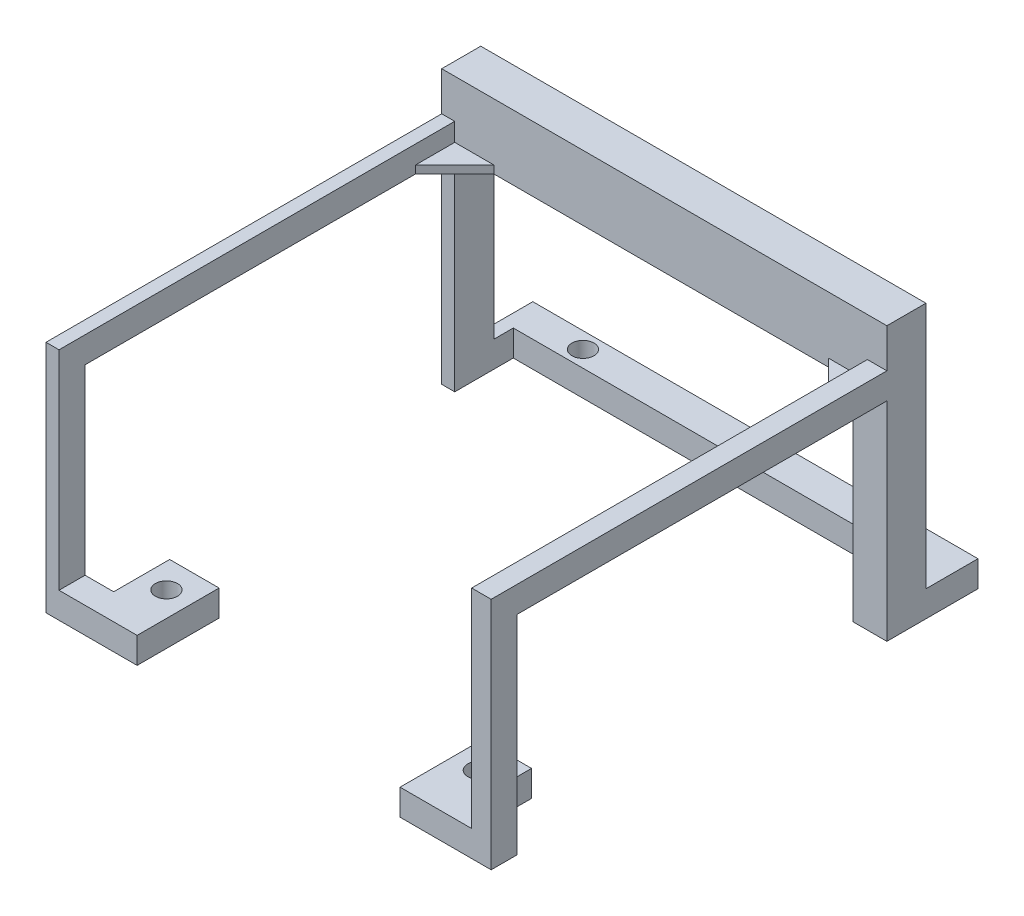
from build123d import *

# Parameters (mm, degrees)
SKETCH1_R                                = 4.25
BOSS_EXTRUDE1_DEPTH                      = 10
BOSS_EXTRUDE2_START                      = -5
BOSS_EXTRUDE2_DEPTH                      = 15
SKETCH3_W                                = 342
SKETCH3_H                                = 10
BOSS_EXTRUDE3_DEPTH                      = 304
CUT_EXTRUDE1_REACH                       = 385.234
BOSS_EXTRUDE4_DEPTH                      = 3
MIRROR5_AT_THE_SECOND_PLANE_COPY_1_DEPTH = 3
BOSS_EXTRUDE5_DEPTH                      = 5
BOSS_EXTRUDE5_DEPTH_BACK                 = 5
BOSS_EXTRUDE6_DEPTH                      = 10
SKETCH10_W                               = 19
SKETCH10_H                               = 21.5
SKETCH10_R                               = 4.25
BOSS_EXTRUDE7_DEPTH                      = 10
CUT_EXTRUDE2_REACH                       = 276.29
SKETCH11_W                               = 2.5
SKETCH11_H                               = 70
MIRROR8_COPY_1_DEPTH                     = 10
MIRROR8_COPY_2_DEPTH                     = 10
MIRROR8_COPY_3_SKETCH_W                  = 19
MIRROR8_COPY_3_SKETCH_H                  = 21.5
MIRROR8_COPY_3_SKETCH_R                  = 4.25
MIRROR8_COPY_3_DEPTH                     = 10
CUT_EXTRUDE5_REACH                       = 415.459
SKETCH14_W                               = 574.948758302
SKETCH14_H                               = 178.61459587
CUT_EXTRUDE6_REACH                       = 276.29
SKETCH15_W                               = 297.993149394
SKETCH15_H                               = 172.333387601


with BuildPart() as part:
    # Sketch1 → Boss-Extrude1 (new body)
    with BuildSketch(Plane(origin=(0, 0, 0), x_dir=(1, 0, 0), z_dir=(0, 1, 0))):
        Polygon((-171, 12.5), (171, 12.5), (171, 0), (171, -12.5), (158, -12.5), (158, 0), (-158, 0), (-158, -12.5), (-171, -12.5), align=None)
        with Locations(Location((-145.5, 6.25, 0), (0, 0, 270))):
            Circle(SKETCH1_R, mode=Mode.SUBTRACT)
        with Locations(Location((145.5, 6.25, 0), (0, 0, 90))):
            Circle(SKETCH1_R, mode=Mode.SUBTRACT)
        with Locations(Location((-25.5, 6.25, 0), (0, 0, 270))):
            Circle(SKETCH1_R, mode=Mode.SUBTRACT)
        with Locations(Location((25.5, 6.25, 0), (0, 0, 270))):
            Circle(SKETCH1_R, mode=Mode.SUBTRACT)
    boss_extrude1 = extrude(amount=BOSS_EXTRUDE1_DEPTH)

    # Sketch2 → Boss-Extrude2 (add)
    with BuildSketch(Plane.XY.offset(12.5).offset(BOSS_EXTRUDE2_START)):
        Polygon((-171, 105), (-171, 0), (-158, 0), (-158, 80), (158, 80), (158, 0), (171, 0), (171, 105), align=None)
    boss_extrude2 = extrude(amount=BOSS_EXTRUDE2_DEPTH)

    # Sketch3 → Boss-Extrude3 (add)
    with BuildSketch(Plane.XY.offset(22.5)):
        with Locations((0, 85)):
            Rectangle(SKETCH3_W, SKETCH3_H)
    extrude(amount=BOSS_EXTRUDE3_DEPTH)

    # Sketch4 → Cut-Extrude1 (cut, up to next)
    with BuildSketch(Plane(origin=(0, 105, 0), x_dir=(1, 0, 0), z_dir=(0, 1, 0)), mode=Mode.PRIVATE) as cut_extrude1_sk1:
        Polygon((-163.5, -22.5), (-5, -22.5), (-5, -326.5), (-163.5, -326.5), (-163.5, -39.75), (-163.5, -34.75), align=None)
    cut_extrude1_tool1 = extrude(cut_extrude1_sk1.sketch, amount=-CUT_EXTRUDE1_REACH, mode=Mode.PRIVATE) & part.part
    # Sketch4 → Cut-Extrude1 (cut, up to next)
    with BuildSketch(Plane(origin=(0, 105, 0), x_dir=(1, 0, 0), z_dir=(0, 1, 0)), mode=Mode.PRIVATE) as cut_extrude1_sk2:
        Polygon((163.5, -22.5), (163.5, -51.4723011), (163.5, -326.5), (5, -326.5), (5, -39.75), (5, -22.5), align=None)
    cut_extrude1_tool2 = extrude(cut_extrude1_sk2.sketch, amount=-CUT_EXTRUDE1_REACH, mode=Mode.PRIVATE) & part.part
    add(cut_extrude1_tool1.solids().sort_by_distance((-84.25, 105, 174.5))[0], mode=Mode.SUBTRACT)
    add(cut_extrude1_tool2.solids().sort_by_distance((84.25, 105, 174.5))[0], mode=Mode.SUBTRACT)

    # Mirror3: Boss-Extrude2 across plane
    add(boss_extrude2.mirror(Plane(origin=(0, 0, 174.5), x_dir=(1, 0, 0), z_dir=(0, 0, -1))))

    # Mirror4: Boss-Extrude1 across plane
    add(boss_extrude1.mirror(Plane(origin=(0, 0, 174.5), x_dir=(1, 0, 0), z_dir=(0, 0, -1))))

    # Sketch7 → Boss-Extrude4 (add)
    with BuildSketch(Plane(origin=(0, 80, 0), x_dir=(-1, 0, 0), z_dir=(0, -1, 0))):
        Polygon((-163.5, -22.5), (-148.5, -22.5), (-163.5, -37.5), align=None)
        Polygon((-5, -22.5), (-20, -22.5), (-5, -37.5), align=None)
    boss_extrude4 = extrude(amount=-BOSS_EXTRUDE4_DEPTH)

    # Mirror5: Boss-Extrude4 across plane
    add(boss_extrude4.mirror(Plane(origin=(0, 0, 174.5), x_dir=(1, 0, 0), z_dir=(0, 0, -1))))

    # Mirror5 at the second plane: Boss-Extrude4 across plane
    add(boss_extrude4.mirror(Plane(origin=(0, 0, 0), x_dir=(0, 0, 1), z_dir=(1, 0, 0))))

    # Mirror5 at the second plane copy 1 sketc → Mirror5 at the second plane copy 1 (add)
    with BuildSketch(Plane(origin=(0, 80, 349), x_dir=(1, 0, 0), z_dir=(0, -1, 0))):
        Polygon((-163.5, -22.5), (-148.5, -22.5), (-163.5, -37.5), align=None)
        Polygon((-5, -22.5), (-20, -22.5), (-5, -37.5), align=None)
    extrude(amount=-MIRROR5_AT_THE_SECOND_PLANE_COPY_1_DEPTH)

    # Sketch8 → Boss-Extrude5 (add, two sides: drawn at the far end of the back side and taken through both)
    with BuildSketch(Plane(origin=(0, 0, 0), x_dir=(0, 0, -1), z_dir=(1, 0, 0)).offset(-BOSS_EXTRUDE5_DEPTH_BACK)):
        Polygon((-326.5, 80), (-341.5, 80), (-341.5, 10), (-349, 10), (-349, 0), (-326.5, 0), align=None)
        Polygon((-22.5, 80), (-7.5, 80), (-7.5, 10), (0, 10), (0, 0), (-22.5, 0), align=None)
    extrude(amount=BOSS_EXTRUDE5_DEPTH + BOSS_EXTRUDE5_DEPTH_BACK)

    # Sketch9 → Boss-Extrude6 (add)
    with BuildSketch(Plane(origin=(0, 0, 174.5), x_dir=(-1, 0, 0), z_dir=(0, 0, -1))):
        Polygon((-163.5, 10), (-136, 10), (-136, 0), (-171, 0), (-171, 80), (-163.5, 80), align=None)
    boss_extrude6 = extrude(amount=BOSS_EXTRUDE6_DEPTH)

    # Sketch10 → Boss-Extrude7 (add)
    with BuildSketch(Plane(origin=(0, 10, 0), x_dir=(1, 0, 0), z_dir=(0, 1, 0))):
        with Locations((145.5, -153.75)):
            Rectangle(SKETCH10_W, SKETCH10_H)
        with Locations(Location((145.5, -153.75, 0), (0, 0, 270))):
            Circle(SKETCH10_R, mode=Mode.SUBTRACT)
    boss_extrude7 = extrude(amount=-BOSS_EXTRUDE7_DEPTH)

    # Mirror6: Boss-Extrude6 across plane
    add(boss_extrude6.mirror(Plane(origin=(85.5, 0, 0), x_dir=(0, 0, 1), z_dir=(1, 0, 0))))

    # Mirror7: Boss-Extrude6, Boss-Extrude7 across plane
    add(boss_extrude6.mirror(Plane(origin=(85.5, 0, 0), x_dir=(0, 0, 1), z_dir=(1, 0, 0))))
    add(boss_extrude7.mirror(Plane(origin=(85.5, 0, 0), x_dir=(0, 0, 1), z_dir=(1, 0, 0))))

    # Sketch11 → Cut-Extrude2 (cut, up to next)
    with BuildSketch(Plane.XY.offset(174.5), mode=Mode.PRIVATE) as cut_extrude2_sk1:
        with Locations((6.25, 45)):
            Rectangle(SKETCH11_W, SKETCH11_H)
    cut_extrude2_tool1 = extrude(cut_extrude2_sk1.sketch, amount=-CUT_EXTRUDE2_REACH, mode=Mode.PRIVATE) & part.part
    cut_extrude2 = cut_extrude2_tool1.solids().sort_by_distance((6.25, 45, 174.5))[0]
    add(cut_extrude2, mode=Mode.SUBTRACT)

    # Mirror8: Boss-Extrude6, Boss-Extrude7 across plane
    add(boss_extrude6.mirror(Plane(origin=(0, 0, 174.5), x_dir=(1, 0, 0), z_dir=(0, 0, -1))))
    add(boss_extrude7.mirror(Plane(origin=(0, 0, 174.5), x_dir=(1, 0, 0), z_dir=(0, 0, -1))))

    # Mirror8 copy 1 sketch → Mirror8 copy 1 (add)
    with BuildSketch(Plane(origin=(171, 0, 174.5), x_dir=(1, 0, 0), z_dir=(0, 0, 1))):
        Polygon((-163.5, 10), (-136, 10), (-136, 0), (-171, 0), (-171, 80), (-163.5, 80), align=None)
    extrude(amount=MIRROR8_COPY_1_DEPTH)

    # Mirror8 copy 2 sketch → Mirror8 copy 2 (add)
    with BuildSketch(Plane(origin=(171, 0, 174.5), x_dir=(1, 0, 0), z_dir=(0, 0, 1))):
        Polygon((-163.5, 10), (-136, 10), (-136, 0), (-171, 0), (-171, 80), (-163.5, 80), align=None)
    extrude(amount=MIRROR8_COPY_2_DEPTH)

    # Mirror8 copy 3 sketch → Mirror8 copy 3 (add)
    with BuildSketch(Plane(origin=(171, 10, 349), x_dir=(-1, 0, 0), z_dir=(0, 1, 0))):
        with Locations((145.5, -153.75)):
            Rectangle(MIRROR8_COPY_3_SKETCH_W, MIRROR8_COPY_3_SKETCH_H)
        with Locations(Location((145.5, -153.75, 0), (0, 0, 270))):
            Circle(MIRROR8_COPY_3_SKETCH_R, mode=Mode.SUBTRACT)
    extrude(amount=-MIRROR8_COPY_3_DEPTH)

    # Mirror9: Cut-Extrude2 across plane
    add(cut_extrude2.mirror(Plane(origin=(0, 0, 174.5), x_dir=(1, 0, 0), z_dir=(0, 0, -1))), mode=Mode.SUBTRACT)

    # Sketch14 → Cut-Extrude5 (cut, up to next)
    with BuildSketch(Plane(origin=(0, 0, 0), x_dir=(0, 0, -1), z_dir=(1, 0, 0)), mode=Mode.PRIVATE) as cut_extrude5_sk1:
        with Locations((-145.651613791, 39.902643452)):
            Rectangle(SKETCH14_W, SKETCH14_H)
    cut_extrude5_tool1 = extrude(cut_extrude5_sk1.sketch, amount=-CUT_EXTRUDE5_REACH, mode=Mode.PRIVATE) & part.part
    add(cut_extrude5_tool1.solids().sort_by_distance((0, 39.902643, 145.651614))[0], mode=Mode.SUBTRACT)

    # Sketch15 → Cut-Extrude6 (cut, up to next)
    with BuildSketch(Plane(origin=(0, 0, 174.5), x_dir=(-1, 0, 0), z_dir=(0, 0, -1)), mode=Mode.PRIVATE) as cut_extrude6_sk1:
        with Locations((-69.086440229, 41.027003033)):
            Rectangle(SKETCH15_W, SKETCH15_H)
    cut_extrude6_tool1 = extrude(cut_extrude6_sk1.sketch, amount=-CUT_EXTRUDE6_REACH, mode=Mode.PRIVATE) & part.part
    add(cut_extrude6_tool1.solids().sort_by_distance((69.08644, 41.027003, 174.5))[0], mode=Mode.SUBTRACT)


solid = part.part
